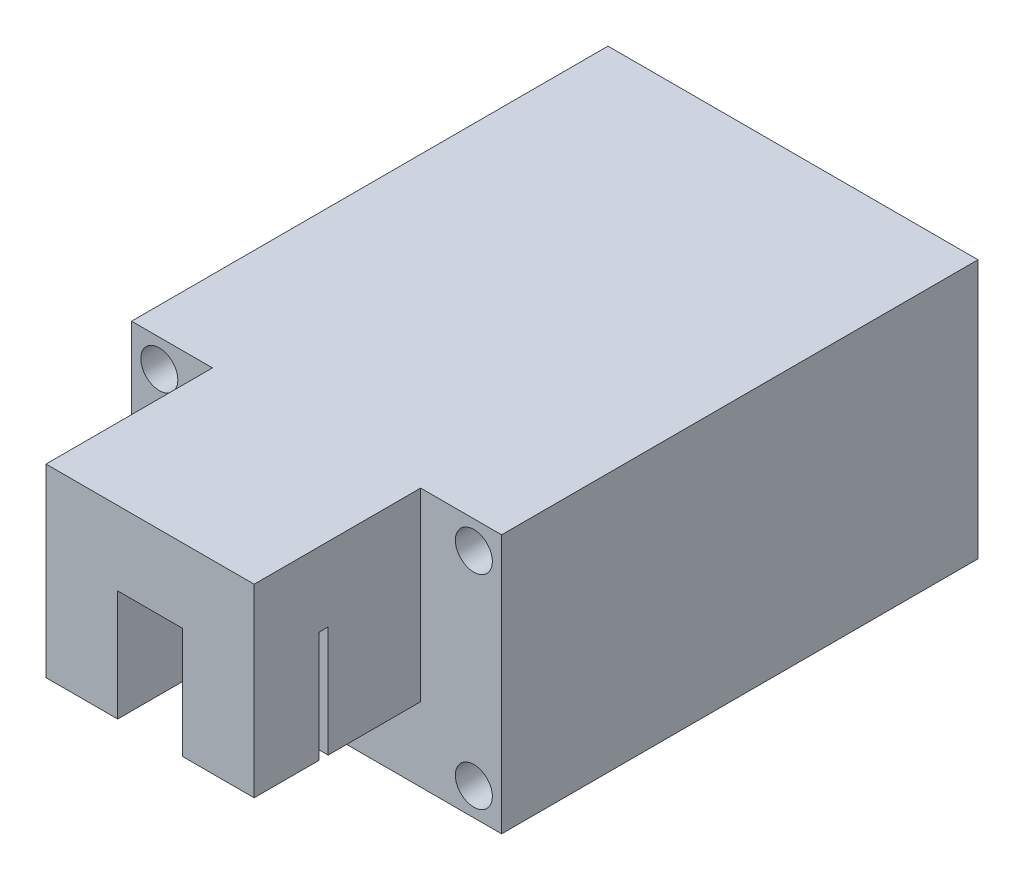
from build123d import *

# Parameters (mm, degrees)
SKETCH_1_W          = 40
SKETCH_1_H          = 28
SKETCH_1_R          = 2
EXTRUDE_1_DEPTH     = 51.5
SKETCH_2_W          = 22.5
SKETCH_2_H          = 20
EXTRUDE_2_DEPTH     = 18
SKETCH_3_W          = 13.5
SKETCH_3_H          = 7
CUT_EXTRUDE_1_DEPTH = 12
SKETCH_4_W          = 22.5
SKETCH_4_H          = 1
CUT_EXTRUDE_2_DEPTH = 12
SKETCH_5_W          = 7
SKETCH_5_H          = 12
CUT_EXTRUDE_3_DEPTH = 7


with BuildPart() as part:
    # 草图1 → 凸台-拉伸1 (new body)
    with BuildSketch(Plane.XY):
        Rectangle(SKETCH_1_W, SKETCH_1_H)
        with Locations((-17, 11)):
            Circle(SKETCH_1_R, mode=Mode.SUBTRACT)
        with Locations((17, 11)):
            Circle(SKETCH_1_R, mode=Mode.SUBTRACT)
        with Locations((-17, -11)):
            Circle(SKETCH_1_R, mode=Mode.SUBTRACT)
        with Locations((17, -11)):
            Circle(SKETCH_1_R, mode=Mode.SUBTRACT)
    extrude(amount=EXTRUDE_1_DEPTH)

    # 草图2 → 凸台-拉伸2 (add)
    with BuildSketch(Plane.XY.offset(51.5)):
        with Locations((0, 4)):
            Rectangle(SKETCH_2_W, SKETCH_2_H)
    extrude(amount=EXTRUDE_2_DEPTH)

    # 草图3 → 切除-拉伸1 (cut)
    with BuildSketch(Plane.XZ.offset(6)):
        with Locations((0, 55)):
            Rectangle(SKETCH_3_W, SKETCH_3_H)
    extrude(amount=-CUT_EXTRUDE_1_DEPTH, mode=Mode.SUBTRACT)

    # 草图4 → 切除-拉伸2 (cut)
    with BuildSketch(Plane.XZ.offset(6)):
        with Locations((0, 62)):
            Rectangle(SKETCH_4_W, SKETCH_4_H)
    extrude(amount=-CUT_EXTRUDE_2_DEPTH, mode=Mode.SUBTRACT)

    # 草图5 → 切除-拉伸3 (cut)
    with BuildSketch(Plane.XY.offset(69.5)):
        Rectangle(SKETCH_5_W, SKETCH_5_H)
    extrude(amount=-CUT_EXTRUDE_3_DEPTH, mode=Mode.SUBTRACT)


solid = part.part
